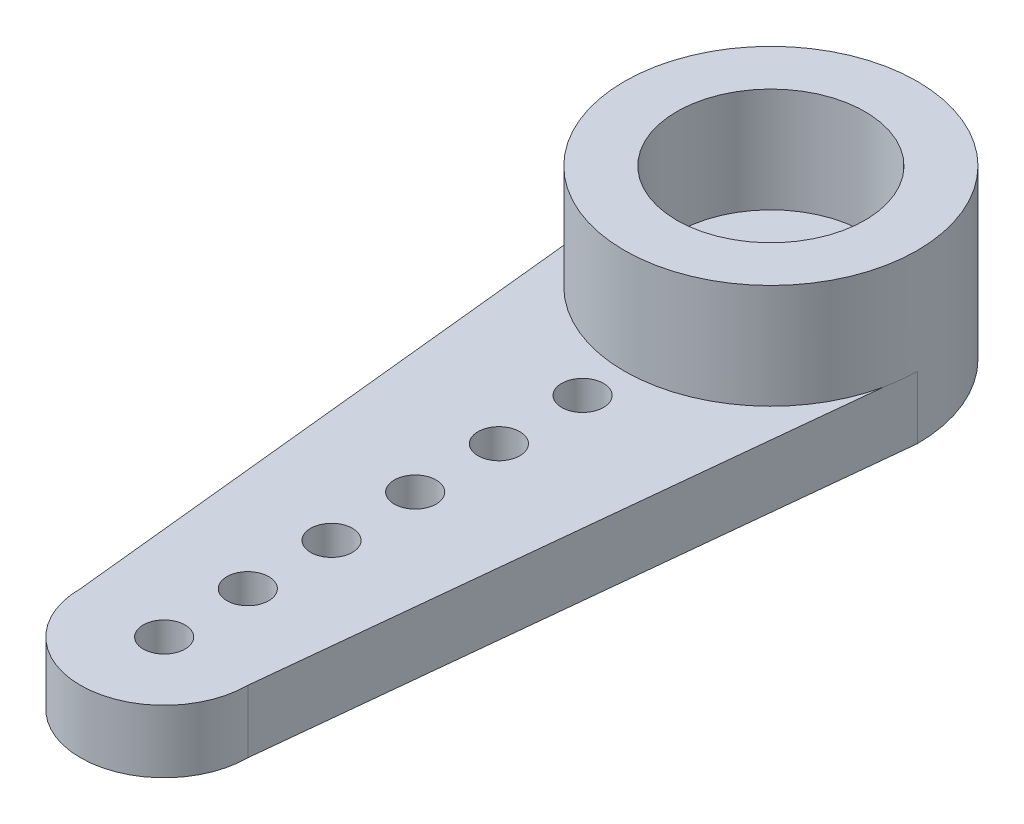
from build123d import *

# Parameters (mm, degrees)
CROQUIS1_R              = 0.5
SALIENTE_EXTRUIR1_DEPTH = 1.5
CROQUIS2_R              = 3.5
CROQUIS2_R_2            = 2.25
SALIENTE_EXTRUIR2_DEPTH = 2.5
CROQUIS3_R              = 2.5
CORTAR_EXTRUIR1_DEPTH   = 1
CROQUIS4_R              = 1
CORTAR_EXTRUIR2_DEPTH   = 1


with BuildPart() as part:
    # Croquis1 → Saliente-Extruir1 (new body)
    with BuildSketch(Plane(origin=(0, 0, 0), x_dir=(1, 0, 0), z_dir=(0, 1, 0))):
        with BuildLine():
            Line((-3.5, 0), (-2, -14.5))
            ThreePointArc((-2, -14.5), (0, -16.5), (2, -14.5))
            Line((2, -14.5), (3.5, 0))
            ThreePointArc((3.5, 0), (0, 3.5), (-3.5, 0))
        make_face()
        with Locations(Location((0, -14.5, 0), (0, 0, 270))):
            Circle(CROQUIS1_R, mode=Mode.SUBTRACT)
        with Locations(Location((0, -12.5, 0), (0, 0, 270))):
            Circle(CROQUIS1_R, mode=Mode.SUBTRACT)
        with Locations(Location((0, -10.5, 0), (0, 0, 270))):
            Circle(CROQUIS1_R, mode=Mode.SUBTRACT)
        with Locations(Location((0, -8.5, 0), (0, 0, 270))):
            Circle(CROQUIS1_R, mode=Mode.SUBTRACT)
        with Locations(Location((0, -6.5, 0), (0, 0, 270))):
            Circle(CROQUIS1_R, mode=Mode.SUBTRACT)
        with Locations(Location((0, -4.5, 0), (0, 0, 270))):
            Circle(CROQUIS1_R, mode=Mode.SUBTRACT)
    extrude(amount=SALIENTE_EXTRUIR1_DEPTH)

    # Croquis2 → Saliente-Extruir2 (add)
    with BuildSketch(Plane(origin=(0, 1.5, 0), x_dir=(1, 0, 0), z_dir=(0, 1, 0))):
        with Locations(Location((0, 0, 0), (0, 0, 180))):
            Circle(CROQUIS2_R)
        with Locations(Location((0, 0, 0), (0, 0, 270))):
            Circle(CROQUIS2_R_2, mode=Mode.SUBTRACT)
    extrude(amount=SALIENTE_EXTRUIR2_DEPTH)

    # Croquis3 → Cortar-Extruir1 (cut)
    with BuildSketch(Plane.XZ):
        with Locations(Location((0, 0, 0), (0, 0, 270))):
            Circle(CROQUIS3_R)
    extrude(amount=-CORTAR_EXTRUIR1_DEPTH, mode=Mode.SUBTRACT)

    # Croquis4 → Cortar-Extruir2 (cut)
    with BuildSketch(Plane(origin=(0, 1.5, 0), x_dir=(1, 0, 0), z_dir=(0, 1, 0))):
        with Locations(Location((0, 0, 0), (0, 0, 270))):
            Circle(CROQUIS4_R)
    extrude(amount=-CORTAR_EXTRUIR2_DEPTH, mode=Mode.SUBTRACT)


solid = part.part
